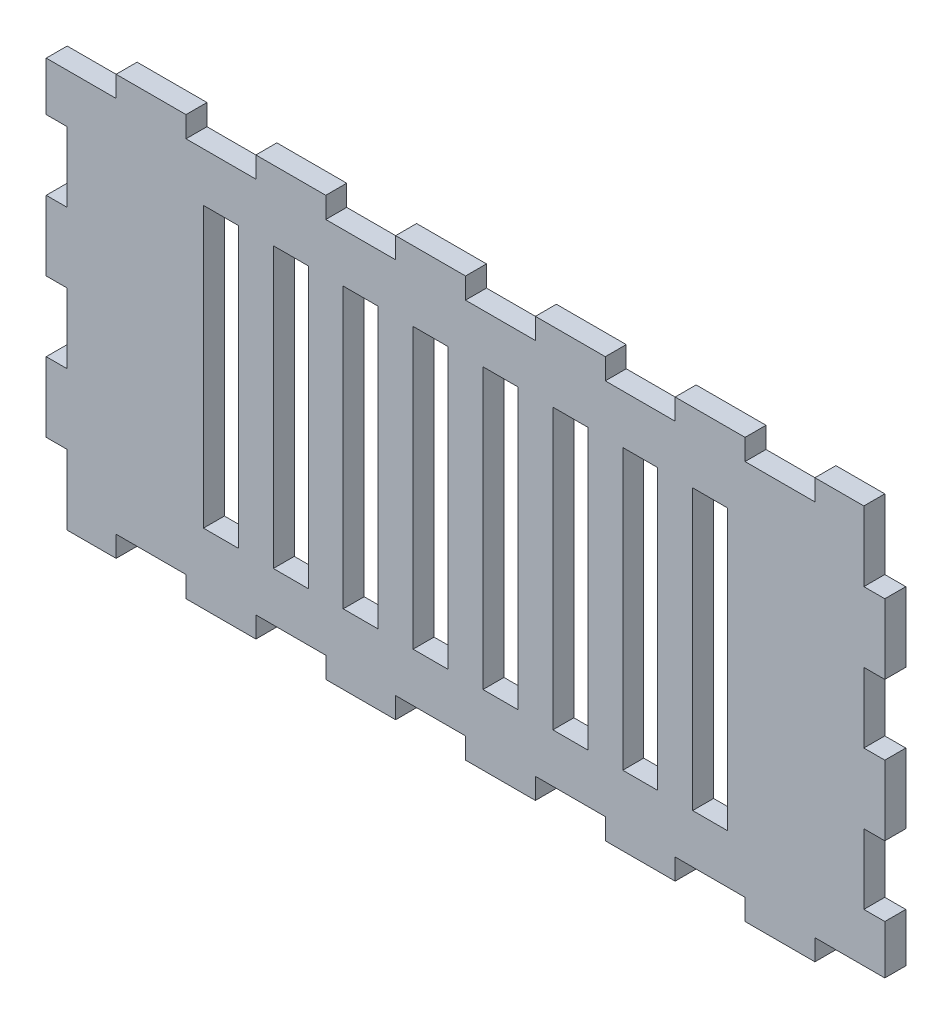
from build123d import *

# Parameters (mm, degrees)
BOSS_EXTRUDE1_DEPTH = 3
SKETCH2_W           = 5
SKETCH2_H           = 40
CUT_EXTRUDE1_DEPTH  = 10


with BuildPart() as part:
    # Sketch1 → Boss-Extrude1 (new body)
    with BuildSketch(Plane.XY):
        Polygon((120, 3), (120, 10), (117, 10), (117, 20), (120, 20), (120, 30), (117, 30), (117, 40), (120, 40), (120, 50), (117, 50), (117, 60), (110, 60), (110, 57), (100, 57), (100, 60), (90, 60), (90, 57), (80, 57), (80, 60), (70, 60), (70, 57), (60, 57), (60, 60), (50, 60), (50, 57), (40, 57), (40, 60), (30, 60), (30, 57), (20, 57), (20, 60), (10, 60), (10, 57), (0, 57), (0, 50), (3, 50), (3, 40), (0, 40), (0, 30), (3, 30), (3, 20), (0, 20), (0, 10), (3, 10), (3, 0), (10, 0), (10, 3), (20, 3), (20, 0), (30, 0), (30, 3), (40, 3), (40, 0), (50, 0), (50, 3), (60, 3), (60, 0), (70, 0), (70, 3), (80, 3), (80, 0), (90, 0), (90, 3), (100, 3), (100, 0), (110, 0), (110, 3), align=None)
    extrude(amount=BOSS_EXTRUDE1_DEPTH)

    # Sketch2 → Cut-Extrude1 (cut)
    with BuildSketch(Plane.XY.offset(3)):
        with Locations((25, 30)):
            Rectangle(SKETCH2_W, SKETCH2_H)
        with Locations((35, 30)):
            Rectangle(SKETCH2_W, SKETCH2_H)
        with Locations((45, 30)):
            Rectangle(SKETCH2_W, SKETCH2_H)
        with Locations((55, 30)):
            Rectangle(SKETCH2_W, SKETCH2_H)
        with Locations((65, 30)):
            Rectangle(SKETCH2_W, SKETCH2_H)
        with Locations((75, 30)):
            Rectangle(SKETCH2_W, SKETCH2_H)
        with Locations((85, 30)):
            Rectangle(SKETCH2_W, SKETCH2_H)
        with Locations((95, 30)):
            Rectangle(SKETCH2_W, SKETCH2_H)
    extrude(amount=-CUT_EXTRUDE1_DEPTH, mode=Mode.SUBTRACT)


solid = part.part
